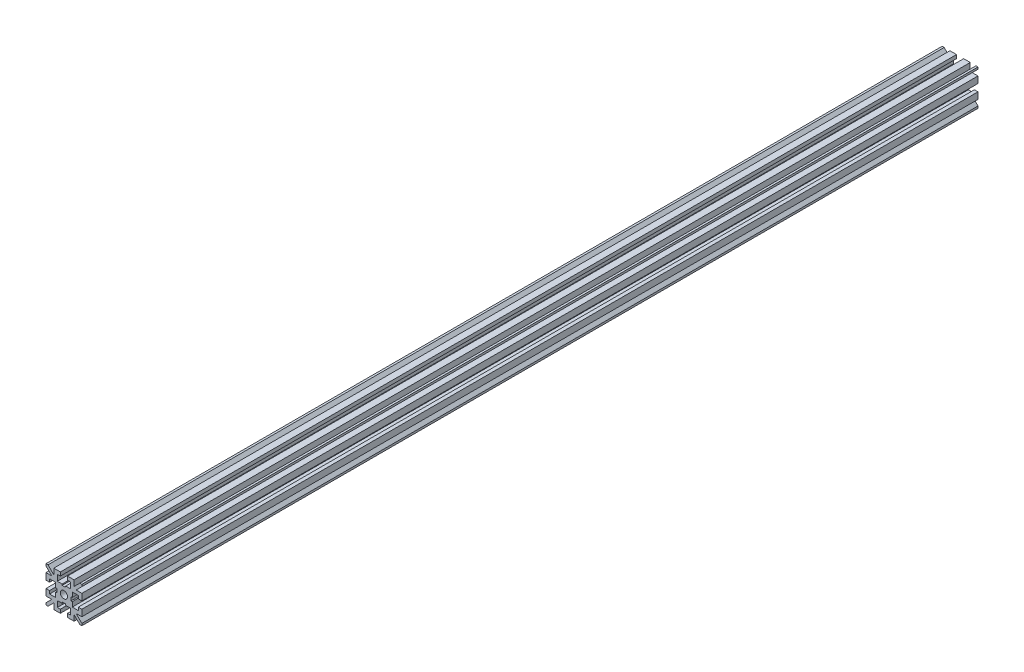
from build123d import *

# Parameters (mm, degrees)
SKETCH1_W           = 15
SKETCH1_H           = 15
BOSS_EXTRUDE1_DEPTH = 375
SKETCH2_R           = 1.5
CUT_EXTRUDE1_DEPTH  = 375
SKETCH3_W           = 3
SKETCH3_H           = 1.5
SKETCH3_W_2         = 1.5
SKETCH3_H_2         = 3
CUT_EXTRUDE2_DEPTH  = 375


with BuildPart() as part:
    # Sketch1 → Boss-Extrude1 (new body)
    with BuildSketch(Plane.XY):
        with Locations((-1.500578266, -3.738353388)):
            Rectangle(SKETCH1_W, SKETCH1_H)
    extrude(amount=BOSS_EXTRUDE1_DEPTH)

    # Sketch2 → Cut-Extrude1 (cut)
    with BuildSketch(Plane.XY.offset(375)):
        with Locations((-1.500578266, -3.738353388)):
            Circle(SKETCH2_R)
        Polygon((1.999421734, -4.488353388), (1.999421734, -6.488353388), (4.499421734, -6.488353388), (4.499421734, -0.988353388), (1.999421734, -0.988353388), (1.999421734, -2.988353388), (1.499421734, -2.988353388), (1.499421734, -4.488353388), align=None)
        Polygon((-4.250578266, -7.238353388), (-4.250578266, -9.738353388), (1.249421734, -9.738353388), (1.249421734, -7.238353388), (-0.750578266, -7.238353388), (-0.750578266, -6.738353388), (-2.250578266, -6.738353388), (-2.250578266, -7.238353388), align=None)
        Polygon((-5.000578266, -0.988353388), (-7.500578266, -0.988353388), (-7.500578266, -6.488353388), (-5.000578266, -6.488353388), (-5.000578266, -4.488353388), (-4.500578266, -4.488353388), (-4.500578266, -2.988353388), (-5.000578266, -2.988353388), align=None)
        Polygon((1.249421734, -0.238353388), (1.249421734, 2.261646612), (-4.250578266, 2.261646612), (-4.250578266, -0.238353388), (-2.250578266, -0.238353388), (-2.250578266, -0.738353388), (-0.750578266, -0.738353388), (-0.750578266, -0.238353388), align=None)
    extrude(amount=-CUT_EXTRUDE1_DEPTH, mode=Mode.SUBTRACT)

    # Sketch3 → Cut-Extrude2 (cut)
    with BuildSketch(Plane.XY.offset(375)):
        Polygon((5.150893596, 3.761646612), (2.749421734, 1.360174749), (2.749421734, 3.761646612), align=None)
        Polygon((5.999421734, 0.511646612), (5.999421734, 2.913118474), (3.597949871, 0.511646612), align=None)
        with Locations((-1.500578266, 3.011646612)):
            Rectangle(SKETCH3_W, SKETCH3_H)
        Polygon((2.749421734, -8.836881526), (2.749421734, -11.238353388), (5.150893596, -11.238353388), align=None)
        Polygon((5.999421734, -10.389825251), (3.597949871, -7.988353388), (5.999421734, -7.988353388), align=None)
        with Locations((5.249421734, -3.738353388)):
            Rectangle(SKETCH3_W_2, SKETCH3_H_2)
        Polygon((-6.599106404, -7.988353388), (-9.000578266, -7.988353388), (-9.000578266, -10.389825251), align=None)
        Polygon((-8.152050129, -11.238353388), (-5.750578266, -8.836881526), (-5.750578266, -11.238353388), align=None)
        with Locations((-1.500578266, -10.488353388)):
            Rectangle(SKETCH3_W, SKETCH3_H)
        Polygon((-5.750578266, 1.360174749), (-5.750578266, 3.761646612), (-8.152050129, 3.761646612), align=None)
        Polygon((-9.000578266, 2.913118474), (-6.599106404, 0.511646612), (-9.000578266, 0.511646612), align=None)
        with Locations((-8.250578266, -3.738353388)):
            Rectangle(SKETCH3_W_2, SKETCH3_H_2)
    extrude(amount=-CUT_EXTRUDE2_DEPTH, mode=Mode.SUBTRACT)


solid = part.part
